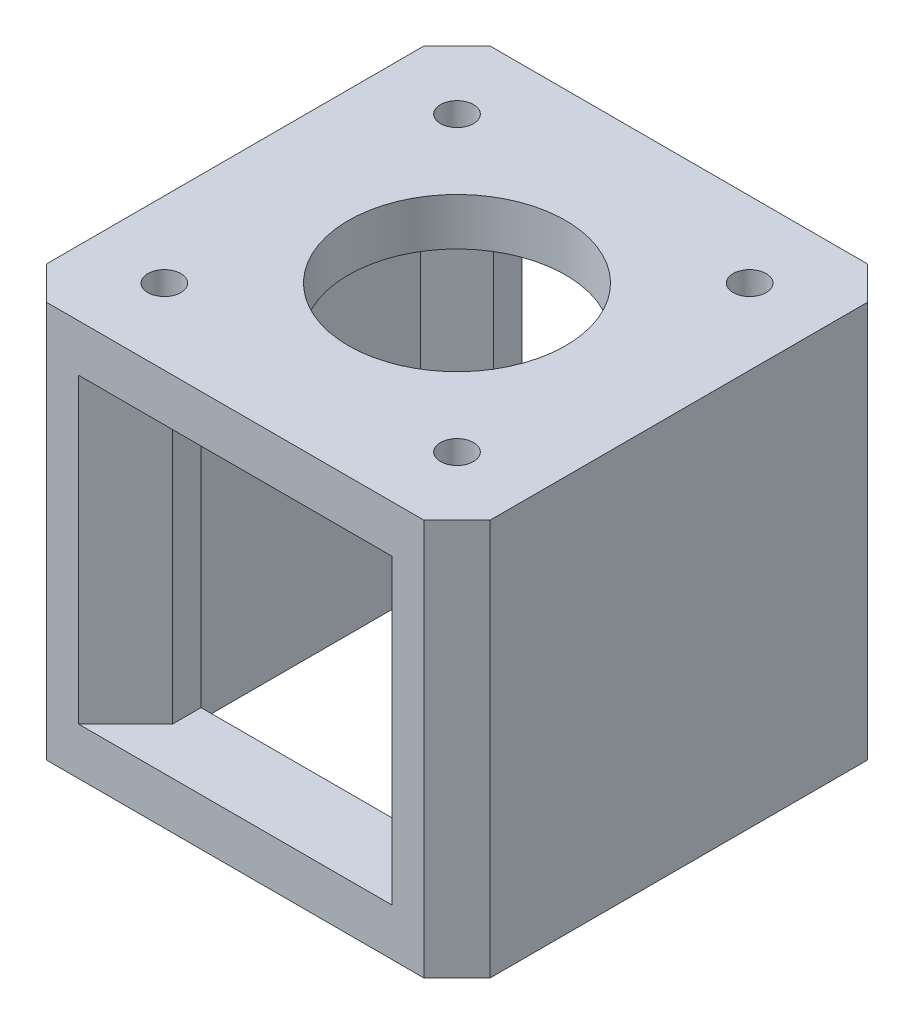
from build123d import *

# Parameters (mm, degrees)
SKETCH1_R           = 1.75
SKETCH1_W           = 8
SKETCH1_H           = 23.221825406
SKETCH1_W_2         = 23.221825406
SKETCH1_H_2         = 8
BOSS_EXTRUDE1_DEPTH = 5
SKETCH1_3_R         = 1.75
SKETCH1_3_W         = 8
SKETCH1_3_H         = 23.221825406
BOSS_EXTRUDE2_DEPTH = 42
BOSS_EXTRUDE3_START = 37
SKETCH1_4_R         = 11.5
SKETCH1_4_W         = 23.221825406
SKETCH1_4_H         = 8
SKETCH1_4_R_2       = 1.75
SKETCH1_4_W_2       = 8
SKETCH1_4_H_2       = 23.221825406
BOSS_EXTRUDE3_DEPTH = 5
CHAMFER2_SIZE       = 5
CHAMFER4_SIZE       = 3.5


with BuildPart() as part:
    # Sketch1 → Boss-Extrude1 (new body)
    # profile 1 of 8: a face of its own
    with BuildSketch(Plane(origin=(0, 0, 0), x_dir=(1, 0, 0), z_dir=(0, 1, 0))):
        Polygon((0, 47), (0, 35.110912703), (8, 35.110912703), (11.889087297, 39), (11.889087297, 47), align=None)
        with Locations(Location((8, 39, 0), (0, 0, 270))):
            Circle(SKETCH1_R, mode=Mode.SUBTRACT)
    # profile 2 of 8: a face of its own
    with BuildSketch(Plane(origin=(0, 0, 0), x_dir=(1, 0, 0), z_dir=(0, 1, 0))):
        with Locations((4, 23.5)):
            Rectangle(SKETCH1_W, SKETCH1_H)
    # profile 3 of 8: a face of its own
    with BuildSketch(Plane(origin=(0, 0, 0), x_dir=(1, 0, 0), z_dir=(0, 1, 0))):
        Polygon((0, 11.889087297), (0, 0), (11.889087297, 0), (11.889087297, 8), (8, 11.889087297), align=None)
        with Locations(Location((8, 8, 0), (0, 0, 270))):
            Circle(SKETCH1_R, mode=Mode.SUBTRACT)
    # profile 4 of 8: a face of its own
    with BuildSketch(Plane(origin=(0, 0, 0), x_dir=(1, 0, 0), z_dir=(0, 1, 0))):
        with Locations((23.5, 4)):
            Rectangle(SKETCH1_W_2, SKETCH1_H_2)
    # profile 5 of 8: a face of its own
    with BuildSketch(Plane(origin=(0, 0, 0), x_dir=(1, 0, 0), z_dir=(0, 1, 0))):
        Polygon((35.110912703, 8), (35.110912703, 0), (47, 0), (47, 11.889087297), (39, 11.889087297), align=None)
        with Locations(Location((39, 8, 0), (0, 0, 270))):
            Circle(SKETCH1_R, mode=Mode.SUBTRACT)
    # profile 6 of 8: a face of its own
    with BuildSketch(Plane(origin=(0, 0, 0), x_dir=(1, 0, 0), z_dir=(0, 1, 0))):
        with Locations((43, 23.5)):
            Rectangle(SKETCH1_W, SKETCH1_H)
    # profile 7 of 8: a face of its own
    with BuildSketch(Plane(origin=(0, 0, 0), x_dir=(1, 0, 0), z_dir=(0, 1, 0))):
        Polygon((39, 35.110912703), (47, 35.110912703), (47, 47), (35.110912703, 47), (35.110912703, 39), align=None)
        with Locations(Location((39, 39, 0), (0, 0, 270))):
            Circle(SKETCH1_R, mode=Mode.SUBTRACT)
    # profile 8 of 8: a face of its own
    with BuildSketch(Plane(origin=(0, 0, 0), x_dir=(1, 0, 0), z_dir=(0, 1, 0))):
        with Locations((23.5, 43)):
            Rectangle(SKETCH1_W_2, SKETCH1_H_2)
    extrude(amount=BOSS_EXTRUDE1_DEPTH)

    # Sketch1<3> → Boss-Extrude2 (add)
    # profile 1 of 6: a face of its own
    with BuildSketch(Plane(origin=(0, 0, 0), x_dir=(1, 0, 0), z_dir=(0, 1, 0))):
        Polygon((0, 11.889087297), (0, 0), (11.889087297, 0), (11.889087297, 8), (8, 11.889087297), align=None)
        with Locations(Location((8, 8, 0), (0, 0, 270))):
            Circle(SKETCH1_3_R, mode=Mode.SUBTRACT)
    # profile 2 of 6: a face of its own
    with BuildSketch(Plane(origin=(0, 0, 0), x_dir=(1, 0, 0), z_dir=(0, 1, 0))):
        Polygon((0, 47), (0, 35.110912703), (8, 35.110912703), (11.889087297, 39), (11.889087297, 47), align=None)
        with Locations(Location((8, 39, 0), (0, 0, 270))):
            Circle(SKETCH1_3_R, mode=Mode.SUBTRACT)
    # profile 3 of 6: a face of its own
    with BuildSketch(Plane(origin=(0, 0, 0), x_dir=(1, 0, 0), z_dir=(0, 1, 0))):
        Polygon((39, 35.110912703), (47, 35.110912703), (47, 47), (35.110912703, 47), (35.110912703, 39), align=None)
        with Locations(Location((39, 39, 0), (0, 0, 270))):
            Circle(SKETCH1_3_R, mode=Mode.SUBTRACT)
    # profile 4 of 6: a face of its own
    with BuildSketch(Plane(origin=(0, 0, 0), x_dir=(1, 0, 0), z_dir=(0, 1, 0))):
        Polygon((35.110912703, 8), (35.110912703, 0), (47, 0), (47, 11.889087297), (39, 11.889087297), align=None)
        with Locations(Location((39, 8, 0), (0, 0, 270))):
            Circle(SKETCH1_3_R, mode=Mode.SUBTRACT)
    # profile 5 of 6: a face of its own
    with BuildSketch(Plane(origin=(0, 0, 0), x_dir=(1, 0, 0), z_dir=(0, 1, 0))):
        with Locations((4, 23.5)):
            Rectangle(SKETCH1_3_W, SKETCH1_3_H)
    # profile 6 of 6: a face of its own
    with BuildSketch(Plane(origin=(0, 0, 0), x_dir=(1, 0, 0), z_dir=(0, 1, 0))):
        with Locations((43, 23.5)):
            Rectangle(SKETCH1_3_W, SKETCH1_3_H)
    extrude(amount=BOSS_EXTRUDE2_DEPTH)

    # Sketch1<4> → Boss-Extrude3 (add)
    # profile 1 of 9: a face of its own
    with BuildSketch(Plane(origin=(0, 0, 0), x_dir=(1, 0, 0), z_dir=(0, 1, 0)).offset(BOSS_EXTRUDE3_START)):
        Polygon((11.889087297, 39), (8, 35.110912703), (8, 11.889087297), (11.889087297, 8), (35.110912703, 8), (39, 11.889087297), (39, 35.110912703), (35.110912703, 39), align=None)
        with Locations(Location((23.5, 23.5, 0), (0, 0, 270))):
            Circle(SKETCH1_4_R, mode=Mode.SUBTRACT)
    # profile 2 of 9: a face of its own
    with BuildSketch(Plane(origin=(0, 0, 0), x_dir=(1, 0, 0), z_dir=(0, 1, 0)).offset(BOSS_EXTRUDE3_START)):
        with Locations((23.5, 43)):
            Rectangle(SKETCH1_4_W, SKETCH1_4_H)
    # profile 3 of 9: a face of its own
    with BuildSketch(Plane(origin=(0, 0, 0), x_dir=(1, 0, 0), z_dir=(0, 1, 0)).offset(BOSS_EXTRUDE3_START)):
        Polygon((0, 47), (0, 35.110912703), (8, 35.110912703), (11.889087297, 39), (11.889087297, 47), align=None)
        with Locations(Location((8, 39, 0), (0, 0, 270))):
            Circle(SKETCH1_4_R_2, mode=Mode.SUBTRACT)
    # profile 4 of 9: a face of its own
    with BuildSketch(Plane(origin=(0, 0, 0), x_dir=(1, 0, 0), z_dir=(0, 1, 0)).offset(BOSS_EXTRUDE3_START)):
        with Locations((4, 23.5)):
            Rectangle(SKETCH1_4_W_2, SKETCH1_4_H_2)
    # profile 5 of 9: a face of its own
    with BuildSketch(Plane(origin=(0, 0, 0), x_dir=(1, 0, 0), z_dir=(0, 1, 0)).offset(BOSS_EXTRUDE3_START)):
        Polygon((0, 11.889087297), (0, 0), (11.889087297, 0), (11.889087297, 8), (8, 11.889087297), align=None)
        with Locations(Location((8, 8, 0), (0, 0, 270))):
            Circle(SKETCH1_4_R_2, mode=Mode.SUBTRACT)
    # profile 6 of 9: a face of its own
    with BuildSketch(Plane(origin=(0, 0, 0), x_dir=(1, 0, 0), z_dir=(0, 1, 0)).offset(BOSS_EXTRUDE3_START)):
        with Locations((23.5, 4)):
            Rectangle(SKETCH1_4_W, SKETCH1_4_H)
    # profile 7 of 9: a face of its own
    with BuildSketch(Plane(origin=(0, 0, 0), x_dir=(1, 0, 0), z_dir=(0, 1, 0)).offset(BOSS_EXTRUDE3_START)):
        Polygon((35.110912703, 8), (35.110912703, 0), (47, 0), (47, 11.889087297), (39, 11.889087297), align=None)
        with Locations(Location((39, 8, 0), (0, 0, 270))):
            Circle(SKETCH1_4_R_2, mode=Mode.SUBTRACT)
    # profile 8 of 9: a face of its own
    with BuildSketch(Plane(origin=(0, 0, 0), x_dir=(1, 0, 0), z_dir=(0, 1, 0)).offset(BOSS_EXTRUDE3_START)):
        with Locations((43, 23.5)):
            Rectangle(SKETCH1_4_W_2, SKETCH1_4_H_2)
    # profile 9 of 9: a face of its own
    with BuildSketch(Plane(origin=(0, 0, 0), x_dir=(1, 0, 0), z_dir=(0, 1, 0)).offset(BOSS_EXTRUDE3_START)):
        Polygon((39, 35.110912703), (47, 35.110912703), (47, 47), (35.110912703, 47), (35.110912703, 39), align=None)
        with Locations(Location((39, 39, 0), (0, 0, 270))):
            Circle(SKETCH1_4_R_2, mode=Mode.SUBTRACT)
    extrude(amount=BOSS_EXTRUDE3_DEPTH)

    # Chamfer2
    chamfer2_edges = [part.edges().sort_by_distance(p)[0] for p in [
        (35.110912703, 21, -47),
        (35.110912703, 21, 0),
        (11.889087297, 21, 0),
        (11.889087297, 21, -47),
    ]]
    chamfer(chamfer2_edges, length=CHAMFER2_SIZE)

    # Chamfer4
    chamfer4_edges = [part.edges().sort_by_distance(p)[0] for p in [
        (0, 21, 0),
        (0, 21, -47),
        (47, 21, -47),
        (47, 21, 0),
    ]]
    chamfer(chamfer4_edges, length=CHAMFER4_SIZE)


solid = part.part
